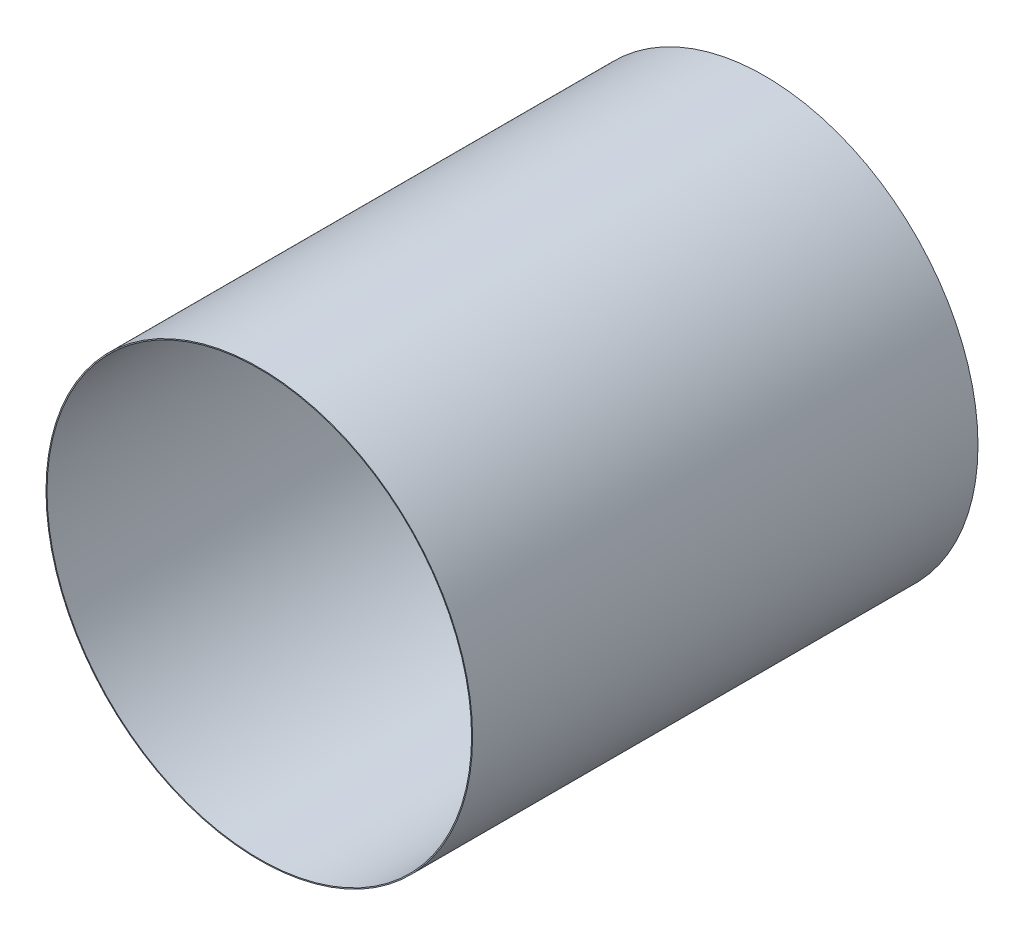
from build123d import *

# Parameters (mm, degrees)
SKETCH1_R           = 10.55
SKETCH1_R_2         = 10.5
BOSS_EXTRUDE1_DEPTH = 25


with BuildPart() as part:
    # Sketch1 → Boss-Extrude1 (new body)
    with BuildSketch(Plane.XY):
        Circle(SKETCH1_R)
        Circle(SKETCH1_R_2, mode=Mode.SUBTRACT)
    extrude(amount=BOSS_EXTRUDE1_DEPTH)


solid = part.part
